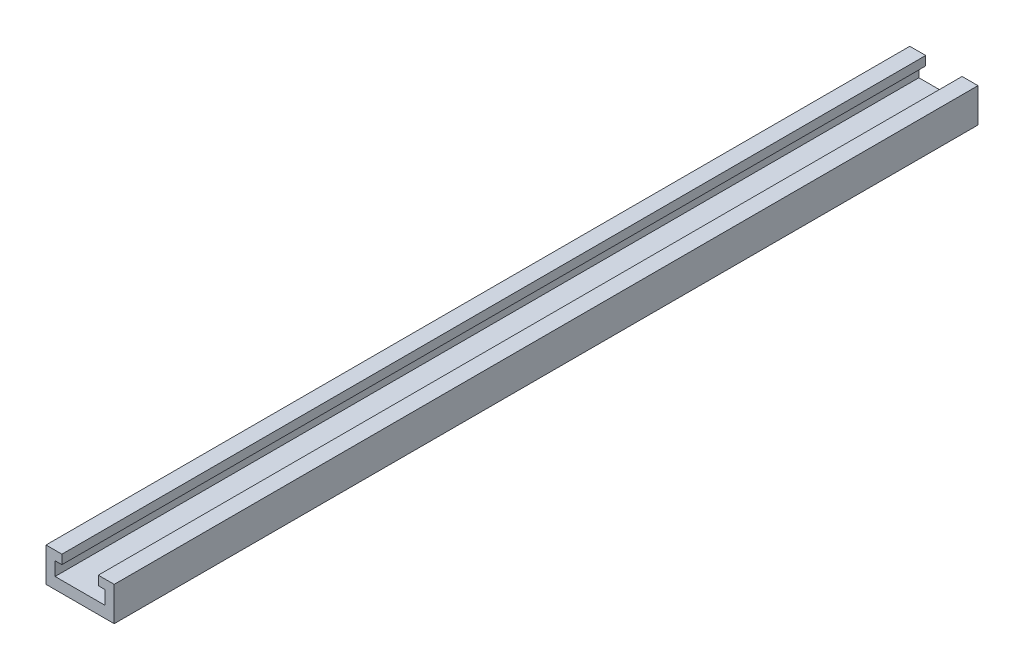
from build123d import *

# Parameters (mm, degrees)
BOSS_EXTRUDE1_DEPTH = 120.65


with BuildPart() as part:
    # Sketch2 → Boss-Extrude1 (new, symmetric)
    with BuildSketch(Plane.XY):
        Polygon((4.445, 9.525), (4.445, 6.985), (2.54, 6.985), (2.54, 3.175), (16.51, 3.175), (16.51, 6.985), (14.605, 6.985), (14.605, 9.525), (19.05, 9.525), (19.05, 0), (0, 0), (0, 9.525), align=None)
    extrude(amount=BOSS_EXTRUDE1_DEPTH, both=True)


solid = part.part
